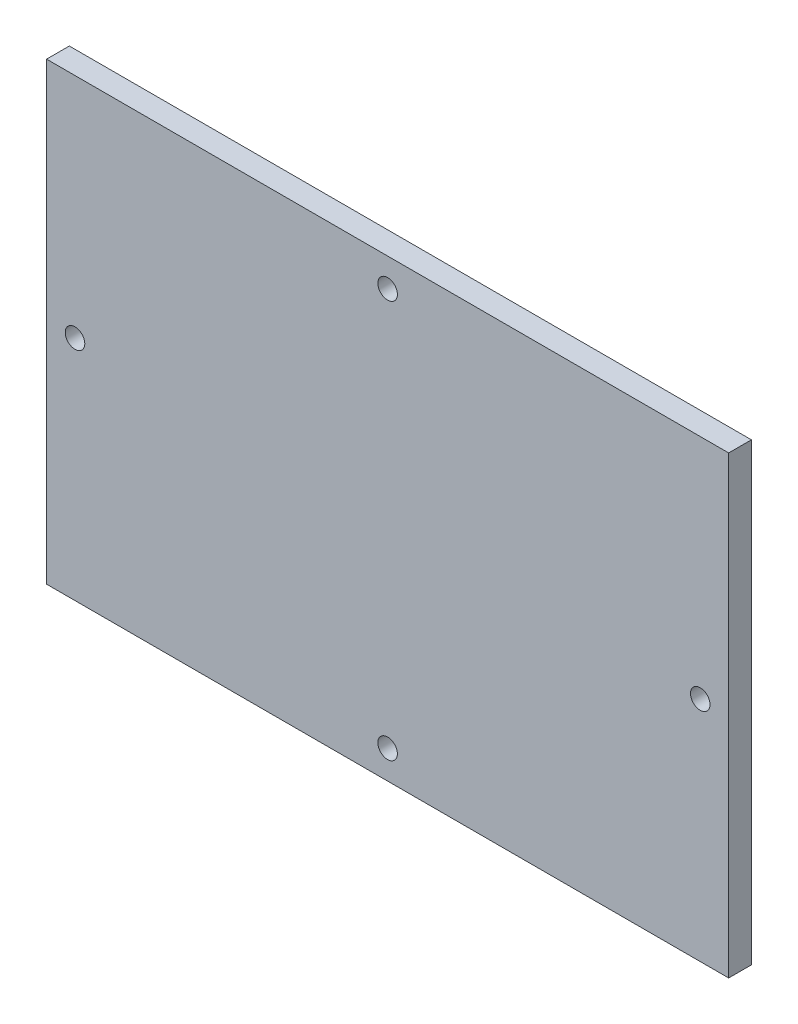
from build123d import *

# Parameters (mm, degrees)
SKETCH2_W           = 76.2
SKETCH2_H           = 50.8
BOSS_EXTRUDE1_DEPTH = 2.54
SKETCH3_R           = 1.0922
CUT_EXTRUDE1_DEPTH  = 2.54


with BuildPart() as part:
    # Sketch2 → Boss-Extrude1 (new body)
    with BuildSketch(Plane.XY):
        Rectangle(SKETCH2_W, SKETCH2_H)
    extrude(amount=BOSS_EXTRUDE1_DEPTH)

    # Sketch3 → Cut-Extrude1 (cut)
    with BuildSketch(Plane.XY.offset(2.54)):
        with Locations((-34.925, 0)):
            Circle(SKETCH3_R)
        with Locations(Location((34.925, 0, 0), (0, 0, 180))):
            Circle(SKETCH3_R)
        with Locations((0, -22.225)):
            Circle(SKETCH3_R)
        with Locations(Location((0, 22.225, 0), (0, 0, 180))):
            Circle(SKETCH3_R)
    extrude(amount=-CUT_EXTRUDE1_DEPTH, mode=Mode.SUBTRACT)


solid = part.part
